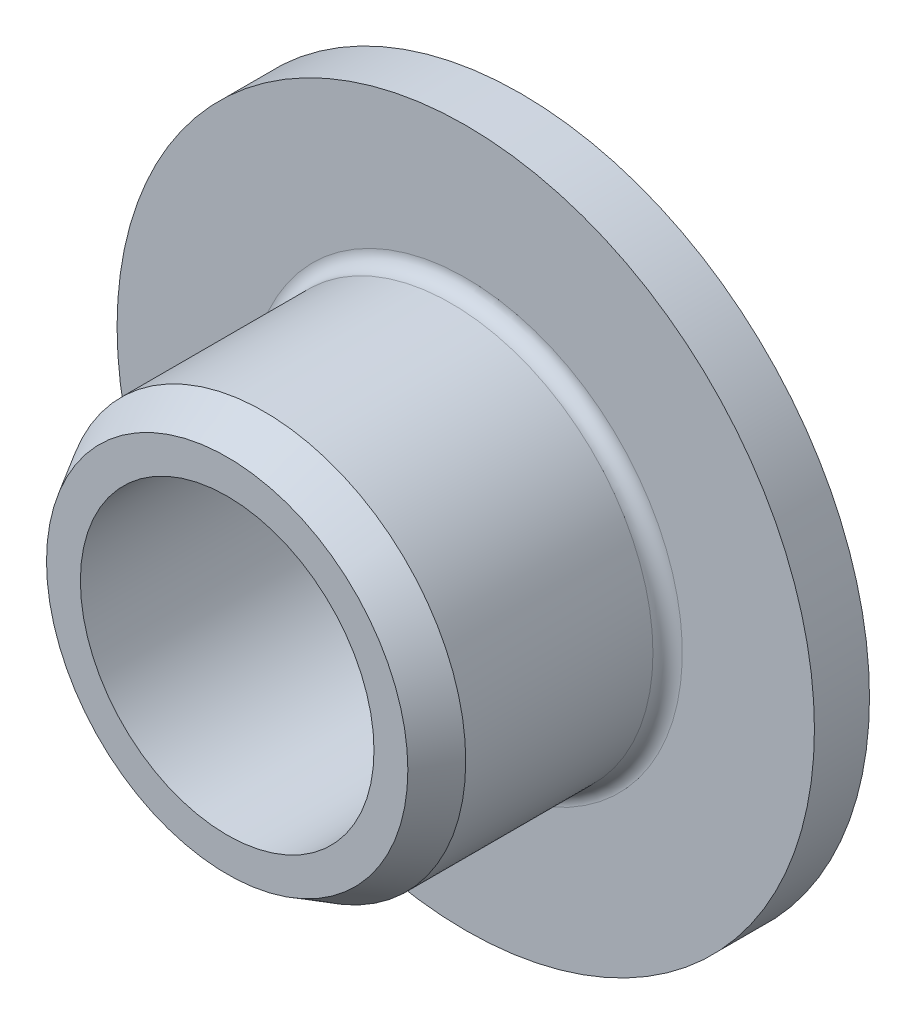
from build123d import *

# Parameters (mm, degrees)
SKICA1_R        = 2.75
SKICA1_R_2      = 2
VYSUNOUT1_DEPTH = 4
SKICA2_R        = 4.75
SKICA2_R_2      = 2.75
VYSUNOUT2_DEPTH = 0.75
ZAOBLIT1_R      = 0.2
ZKOSIT1_SIZE    = 0.5
ZKOSIT1_SIZE2   = 0.288675135
ZKOSIT2_SIZE    = 0.288675135
ZKOSIT2_SIZE2   = 0.5


with BuildPart() as part:
    # Skica1 → Vysunout1 (new body)
    with BuildSketch(Plane.XY):
        Circle(SKICA1_R)
        Circle(SKICA1_R_2, mode=Mode.SUBTRACT)
    extrude(amount=VYSUNOUT1_DEPTH)

    # Skica2 → Vysunout2 (add)
    with BuildSketch(Plane(origin=(0, 0, 0), x_dir=(-1, 0, 0), z_dir=(0, 0, -1))):
        Circle(SKICA2_R)
        Circle(SKICA2_R_2, mode=Mode.SUBTRACT)
    extrude(amount=-VYSUNOUT2_DEPTH)

    # Zaoblit1
    zaoblit1_edges = [part.edges().sort_by_distance(p)[0] for p in [
        (-2.75, 0, 0.75),
    ]]
    fillet(zaoblit1_edges, radius=ZAOBLIT1_R)

    # Zkosit1
    zkosit1_edges = [part.edges().sort_by_distance(p)[0] for p in [
        (-2, 0, 0),
    ]]
    zkosit1_side = [part.faces().sort_by_distance(p)[0] for p in [
        (-2, 0, 2),
    ]]
    chamfer(zkosit1_edges, length=ZKOSIT1_SIZE, length2=ZKOSIT1_SIZE2, reference=zkosit1_side[0])

    # Zkosit2
    zkosit2_edges = [part.edges().sort_by_distance(p)[0] for p in [
        (-2.75, 0, 4),
    ]]
    zkosit2_side = [part.faces().sort_by_distance(p)[0] for p in [
        (-2.672218254, 0, 4),
    ]]
    chamfer(zkosit2_edges, length=ZKOSIT2_SIZE, length2=ZKOSIT2_SIZE2, reference=zkosit2_side[0])


solid = part.part
